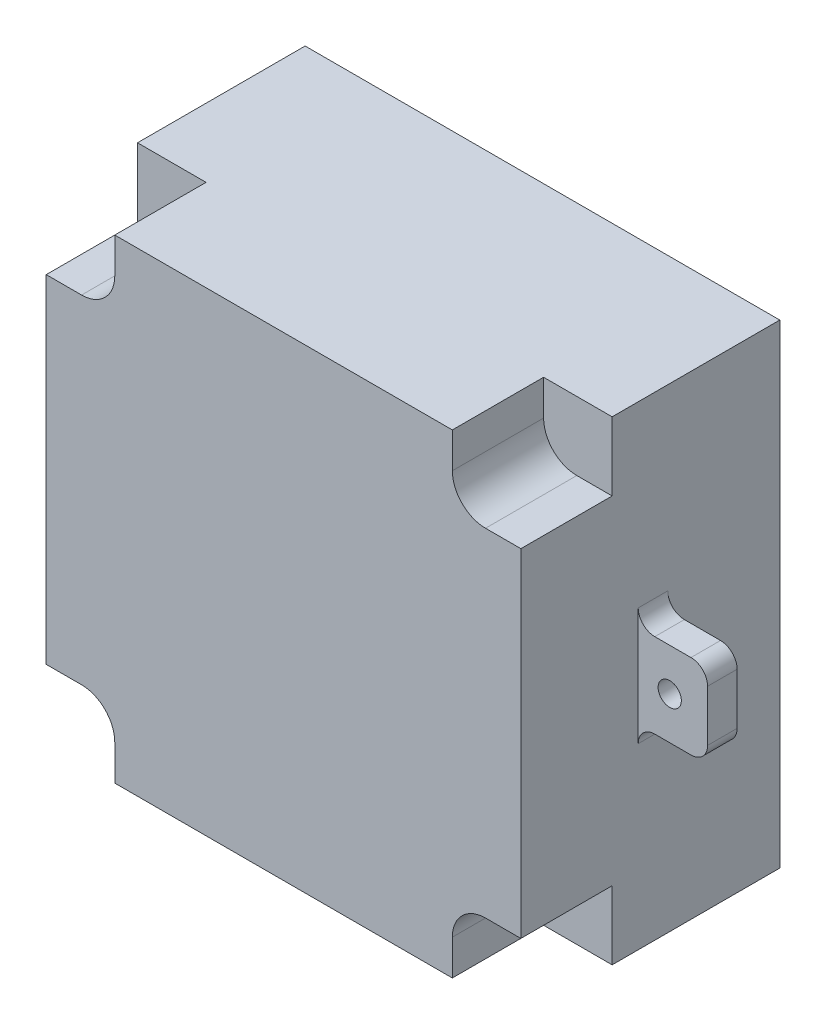
from build123d import *

# Parameters (mm, degrees)
SKETCH_1_W          = 57.2
SKETCH_1_H          = 57.2
EXTRUDE_1_DEPTH     = 20.2
EXTRUDE_2_DEPTH     = 11
FILLET_1_R          = 4
SKETCH_3_W          = 8.36
SKETCH_3_H          = 10.17
EXTRUDE_3_DEPTH     = 3.56
FILLET_2_R          = 2
CUT_EXTRUDE_1_REACH = 335.105
SKETCH_4_R          = 1.4


with BuildPart() as part:
    # 草图1 → 凸台-拉伸1 (new body)
    with BuildSketch(Plane.XY):
        with Locations((288.826790697, 38.544140377)):
            Rectangle(SKETCH_1_W, SKETCH_1_H)
    extrude(amount=EXTRUDE_1_DEPTH)

    # 草图2 → 凸台-拉伸2 (add)
    with BuildSketch(Plane.XY.offset(20.2)):
        Polygon((260.226790697, 58.884140377), (268.486790697, 58.884140377), (268.486790697, 67.144140377), (309.166790697, 67.144140377), (309.166790697, 58.884140377), (317.426790697, 58.884140377), (317.426790697, 18.204140377), (309.166790697, 18.204140377), (309.166790697, 9.944140377), (268.486790697, 9.944140377), (268.486790697, 18.204140377), (260.226790697, 18.204140377), align=None)
    extrude(amount=EXTRUDE_2_DEPTH)

    # 圆角1
    fillet_1_edges = [part.edges().sort_by_distance(p)[0] for p in [
        (268.486790697, 58.884140377, 25.7),
        (268.486790697, 18.204140377, 25.7),
        (309.166790697, 18.204140377, 25.7),
        (309.166790697, 58.884140377, 25.7),
    ]]
    fillet(fillet_1_edges, radius=FILLET_1_R)

    # 草图3 → 凸台-拉伸3 (add)
    with BuildSketch(Plane(origin=(0, 0, 13.5), x_dir=(-1, 0, 0), z_dir=(0, 0, -1))):
        with Locations((-256.046790697, 38.544140377)):
            Rectangle(SKETCH_3_W, SKETCH_3_H)
        with Locations((-321.606790697, 38.544140377)):
            Rectangle(SKETCH_3_W, SKETCH_3_H)
    extrude(amount=-EXTRUDE_3_DEPTH)

    # 圆角2
    fillet_2_edges = [part.edges().sort_by_distance(p)[0] for p in [
        (251.866790697, 43.629140377, 15.28),
        (251.866790697, 33.459140377, 15.28),
        (260.226790697, 33.459140377, 15.28),
        (260.226790697, 43.629140377, 15.28),
        (317.426790697, 43.629140377, 15.28),
        (317.426790697, 33.459140377, 15.28),
        (325.786790697, 33.459140377, 15.28),
        (325.786790697, 43.629140377, 15.28),
    ]]
    fillet(fillet_2_edges, radius=FILLET_2_R)

    # 草图4 → 切除-拉伸1 (cut, up to next)
    with BuildSketch(Plane(origin=(0, 0, 13.5), x_dir=(-1, 0, 0), z_dir=(0, 0, -1)), mode=Mode.PRIVATE) as cut_extrude_1_sk1:
        with Locations((-256.426790697, 38.544140377)):
            Circle(SKETCH_4_R)
    cut_extrude_1_tool1 = extrude(cut_extrude_1_sk1.sketch, amount=-CUT_EXTRUDE_1_REACH, mode=Mode.PRIVATE) & part.part
    # 草图4 → 切除-拉伸1 (cut, up to next)
    with BuildSketch(Plane(origin=(0, 0, 13.5), x_dir=(-1, 0, 0), z_dir=(0, 0, -1)), mode=Mode.PRIVATE) as cut_extrude_1_sk2:
        with Locations((-321.226790697, 38.544140377)):
            Circle(SKETCH_4_R)
    cut_extrude_1_tool2 = extrude(cut_extrude_1_sk2.sketch, amount=-CUT_EXTRUDE_1_REACH, mode=Mode.PRIVATE) & part.part
    add(cut_extrude_1_tool1.solids().sort_by_distance((256.426791, 38.54414, 13.5))[0], mode=Mode.SUBTRACT)
    add(cut_extrude_1_tool2.solids().sort_by_distance((321.226791, 38.54414, 13.5))[0], mode=Mode.SUBTRACT)


solid = part.part
